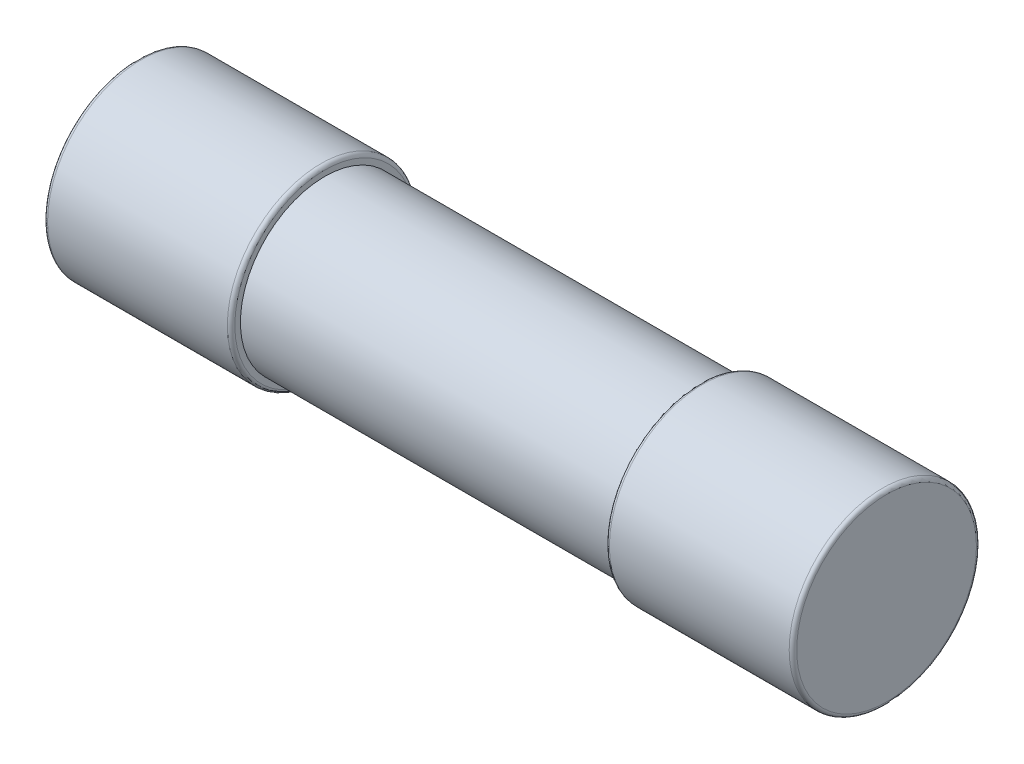
from build123d import *

# Parameters (mm, degrees)
SCHIZZO4_W  = 19.5
SCHIZZO4_H  = 0.25
RACCORDO1_R = 0.1


with BuildPart() as part:
    # Schizzo4 → Rivoluzione3 (revolve)
    with BuildSketch(Plane.XY):
        with Locations((0, 2.125)):
            Rectangle(SCHIZZO4_W, SCHIZZO4_H)
    revolve(axis=Axis((0, 0, 0), (-1, 0, 0)))


with BuildPart() as body_2:
    # Schizzo6 → Rivoluzione4 (revolve)
    with BuildSketch(Plane.XY, mode=Mode.PRIVATE) as rivoluzione4_sk:
        Polygon((-9.75, 0), (0, 0), (0, 0.1), (-9.75, 0.1), (-9.75, 2.25), (-5, 2.25), (-5, 2.5), (-10, 2.5), (-10, 0), align=None)
        Polygon((0, 0), (9.75, 0), (10, 0), (10, 2.5), (5, 2.5), (5, 2.25), (9.75, 2.25), (9.75, 0.1), (0, 0.1), align=None)
    revolve(rivoluzione4_sk.sketch.rotate(Axis((9.75, 0, 0), (-1, 0, 0)), 90), axis=Axis((9.75, 0, 0), (-1, 0, 0)))

    # Raccordo1
    raccordo1_edges = [body_2.edges().sort_by_distance(p)[0] for p in [
        (-10, 0, 2.5),
        (-5, 0, 2.5),
        (5, 0, 2.5),
        (10, 0, 2.5),
    ]]
    fillet(raccordo1_edges, radius=RACCORDO1_R)


solid = Compound([part.part, body_2.part])
